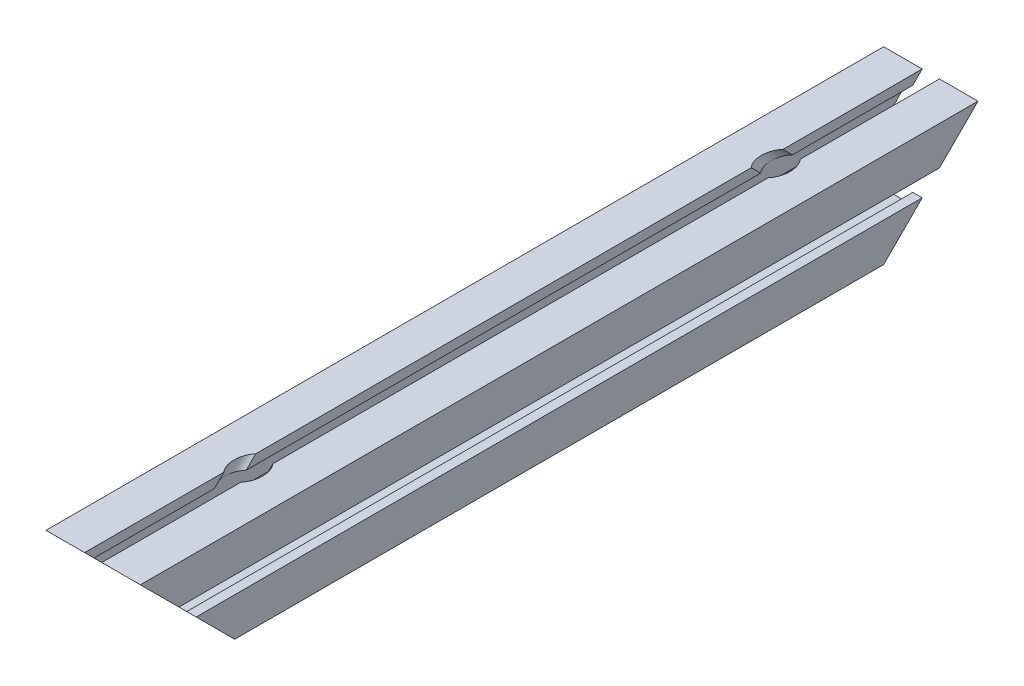
from build123d import *

# Parameters (mm, degrees)
EXTRUDE1_DEPTH      = 199.757665685
EXTRUDE1_DEPTH_BACK = 199.757665685
SKETCH1_R           = 6
SKETCH1_R_2         = 3.75
EXTRUDE2_DEPTH      = 206.996055787
SKETCH3_R           = 4.25
EXTRUDE3_DEPTH      = 310.875200721
SKETCH4_R           = 6.75
SKETCH4_R_2         = 4.25
EXTRUDE4_DEPTH      = 291.32812148


with BuildPart() as part:
    # Sketch1 → Extrude1 (new, two sides: drawn at the far end of the back side and taken through both)
    with BuildSketch(Plane.XY.offset(-EXTRUDE1_DEPTH_BACK)):
        Polygon((-18, -4.1), (-22.5, -4.1), (-22.5, -22.5), (-4.1, -22.5), (-4.1, -18), (-6.8, -18), (-6.8, -9.5), (-4.5, -7.2), (4.5, -7.2), (6.8, -9.5), (6.8, -18), (4.1, -18), (4.1, -22.5), (22.5, -22.5), (22.5, -4.1), (18, -4.1), (18, -6.8), (9.5, -6.8), (7.2, -4.5), (7.2, 4.5), (9.5, 6.8), (18, 6.8), (18, 4.1), (22.5, 4.1), (22.5, 22.5), (4.1, 22.5), (4.1, 18), (6.8, 18), (6.8, 9.5), (4.5, 7.2), (-4.5, 7.2), (-6.8, 9.5), (-6.8, 18), (-4.1, 18), (-4.1, 22.5), (-22.5, 22.5), (-22.5, 4.1), (-18, 4.1), (-18, 6.8), (-9.5, 6.8), (-7.2, 4.5), (-7.2, -4.5), (-9.5, -6.8), (-18, -6.8), align=None)
        with Locations((14.65, -14.65)):
            Circle(SKETCH1_R, mode=Mode.SUBTRACT)
        with Locations((-14.65, -14.65)):
            Circle(SKETCH1_R, mode=Mode.SUBTRACT)
        Circle(SKETCH1_R_2, mode=Mode.SUBTRACT)
        with Locations((14.65, 14.65)):
            Circle(SKETCH1_R, mode=Mode.SUBTRACT)
        with Locations((-14.65, 14.65)):
            Circle(SKETCH1_R, mode=Mode.SUBTRACT)
    extrude(amount=EXTRUDE1_DEPTH + EXTRUDE1_DEPTH_BACK)

    # Sketch2 → Extrude2 (cut, through all)
    with BuildSketch(Plane(origin=(22.5, 0, 0), x_dir=(0, 0, -1), z_dir=(1, 0, 0))):
        Polygon((-181.357665685, 4.1), (-199.757665685, 4.1), (-199.757665685, -22.5), (-154.757665685, -22.5), align=None)
        Polygon((-199.757665685, 22.5), (-199.757665685, 4.1), (-181.357665685, 4.1), align=None)
        Polygon((199.757665685, 4.1), (181.357665685, 4.1), (154.757665685, -22.5), (199.757665685, -22.5), align=None)
        Polygon((199.757665685, 22.5), (181.357665685, 4.1), (199.757665685, 4.1), align=None)
    extrude(amount=-EXTRUDE2_DEPTH, mode=Mode.SUBTRACT)

    # Sketch3 → Extrude3 (cut, through all)
    with BuildSketch(Plane(origin=(0, -88.628832842, 88.628832842), x_dir=(1, 0, 0), z_dir=(0, -0.707106781186557, 0.7071067811865381))):
        with Locations(Location((0, 104.835902577, 0), (0, 0, 90))):
            Circle(SKETCH3_R)
    extrude3 = extrude(amount=-EXTRUDE3_DEPTH, mode=Mode.SUBTRACT)

    # Sketch4 → Extrude4 (cut, through all)
    with BuildSketch(Plane(origin=(0, -73.362397437, 73.362397437), x_dir=(1, 0, 0), z_dir=(0, -0.707106781186557, 0.7071067811865381))):
        with Locations(Location((0, 104.835902577, 0), (0, 0, 270))):
            Circle(SKETCH4_R)
        with Locations(Location((0, 104.835902577, 0), (0, 0, 329.881821744))):
            Circle(SKETCH4_R_2, mode=Mode.SUBTRACT)
    extrude4 = extrude(amount=-EXTRUDE4_DEPTH, mode=Mode.SUBTRACT)

    # Mirror1: Extrude3, Extrude4 across plane
    add(extrude3.mirror(Plane.XY), mode=Mode.SUBTRACT)
    add(extrude4.mirror(Plane.XY), mode=Mode.SUBTRACT)


solid = part.part
